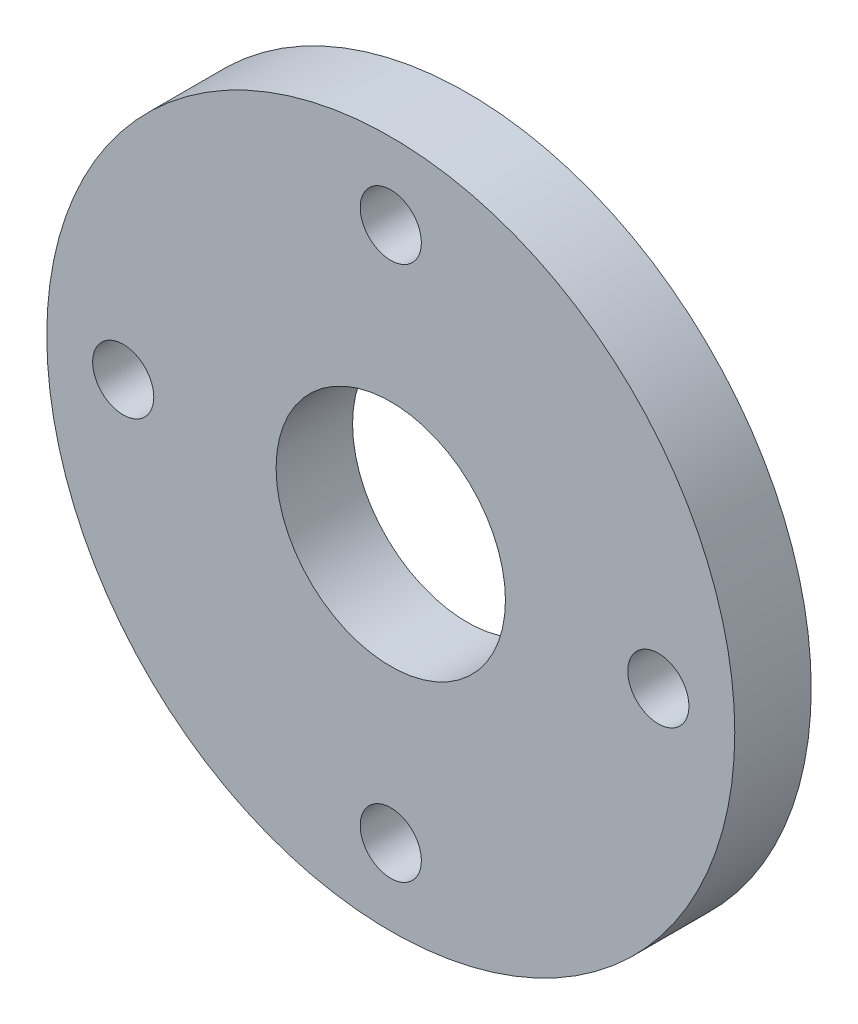
from build123d import *

# Parameters (mm, degrees)
SKETCH_1_R               = 22.5
EXTRUDE_1_DEPTH          = 5
SKETCH_2_R               = 7.5
CUT_EXTRUDE_1_DEPTH      = 33.210246817
CUT_EXTRUDE_2_DEPTH      = 33.210246817
CUT_EXTRUDE_2_DEPTH_BACK = 33.210246817
SKETCH_3_R               = 2


with BuildPart() as part:
    # 草图1 → 凸台-拉伸1 (new body)
    with BuildSketch(Plane.XY):
        Circle(SKETCH_1_R)
    extrude(amount=EXTRUDE_1_DEPTH)

    # 草图2 → 切除-拉伸1 (cut, through all)
    with BuildSketch(Plane.XY.offset(5)):
        Circle(SKETCH_2_R)
    extrude(amount=-CUT_EXTRUDE_1_DEPTH, mode=Mode.SUBTRACT)

    # 草图3 → 切除-拉伸2 (cut, two sides: drawn at the far end of the back side and taken through both)
    with BuildSketch(Plane.XY.offset(5).offset(-CUT_EXTRUDE_2_DEPTH_BACK)):
        with Locations((-17.5, 0)):
            Circle(SKETCH_3_R)
        with Locations((0, -17.5)):
            Circle(SKETCH_3_R)
        with Locations((17.5, 0)):
            Circle(SKETCH_3_R)
        with Locations((0, 17.5)):
            Circle(SKETCH_3_R)
    extrude(amount=CUT_EXTRUDE_2_DEPTH + CUT_EXTRUDE_2_DEPTH_BACK, mode=Mode.SUBTRACT)


solid = part.part
